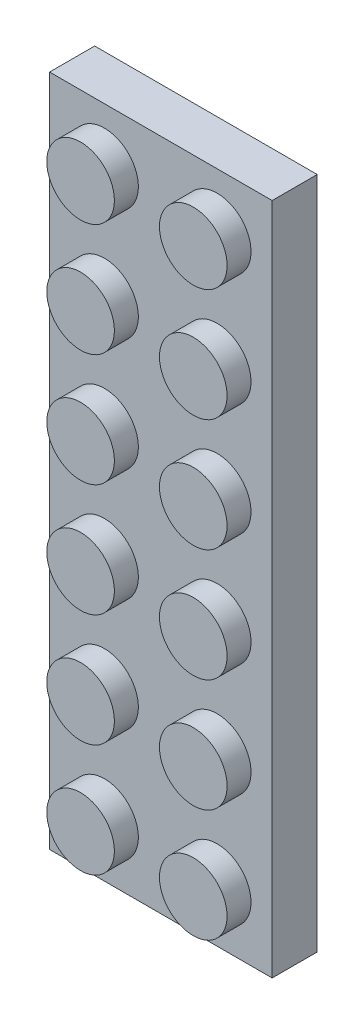
from build123d import *

# Parameters (mm, degrees)
SKETCH_1_W          = 15.8
SKETCH_1_H          = 47.8
EXTRUDE_1_DEPTH     = 3.2
SKETCH_2_R          = 2.4
EXTRUDE_2_DEPTH     = 1.7
SKETCH_3_R          = 2.5
CUT_EXTRUDE_2_DEPTH = 1.8


with BuildPart() as part:
    # Эскиз1 → Бобышка-Вытянуть1 (new body)
    with BuildSketch(Plane.XY):
        Rectangle(SKETCH_1_W, SKETCH_1_H)
    extrude(amount=EXTRUDE_1_DEPTH)

    # Эскиз2 → Бобышка-Вытянуть2 (add)
    with BuildSketch(Plane.XY.offset(3.2)):
        with Locations(Location((-4, 20, 0), (0, 0, 180))):
            Circle(SKETCH_2_R)
        with Locations(Location((4, 20, 0), (0, 0, 180))):
            Circle(SKETCH_2_R)
        with Locations(Location((4, 12, 0), (0, 0, 180))):
            Circle(SKETCH_2_R)
        with Locations(Location((4, 4, 0), (0, 0, 180))):
            Circle(SKETCH_2_R)
        with Locations(Location((4, -4, 0), (0, 0, 180))):
            Circle(SKETCH_2_R)
        with Locations(Location((4, -12, 0), (0, 0, 180))):
            Circle(SKETCH_2_R)
        with Locations(Location((4, -20, 0), (0, 0, 180))):
            Circle(SKETCH_2_R)
        with Locations(Location((-4, 12, 0), (0, 0, 180))):
            Circle(SKETCH_2_R)
        with Locations(Location((-4, 4, 0), (0, 0, 180))):
            Circle(SKETCH_2_R)
        with Locations(Location((-4, -4, 0), (0, 0, 180))):
            Circle(SKETCH_2_R)
        with Locations(Location((-4, -12, 0), (0, 0, 180))):
            Circle(SKETCH_2_R)
        with Locations(Location((-4, -20, 0), (0, 0, 180))):
            Circle(SKETCH_2_R)
    extrude(amount=EXTRUDE_2_DEPTH)

    # Эскиз3 → Вырез-Вытянуть2 (cut)
    with BuildSketch(Plane(origin=(0, 0, 0), x_dir=(-1, 0, 0), z_dir=(0, 0, -1))):
        with Locations((-4, 20)):
            Circle(SKETCH_3_R)
        with Locations((4, 20)):
            Circle(SKETCH_3_R)
        with Locations((4, 12)):
            Circle(SKETCH_3_R)
        with Locations((4, 4)):
            Circle(SKETCH_3_R)
        with Locations((4, -4)):
            Circle(SKETCH_3_R)
        with Locations((4, -12)):
            Circle(SKETCH_3_R)
        with Locations((4, -20)):
            Circle(SKETCH_3_R)
        with Locations((-4, 12)):
            Circle(SKETCH_3_R)
        with Locations((-4, 4)):
            Circle(SKETCH_3_R)
        with Locations((-4, -4)):
            Circle(SKETCH_3_R)
        with Locations((-4, -12)):
            Circle(SKETCH_3_R)
        with Locations((-4, -20)):
            Circle(SKETCH_3_R)
    extrude(amount=-CUT_EXTRUDE_2_DEPTH, mode=Mode.SUBTRACT)


solid = part.part
